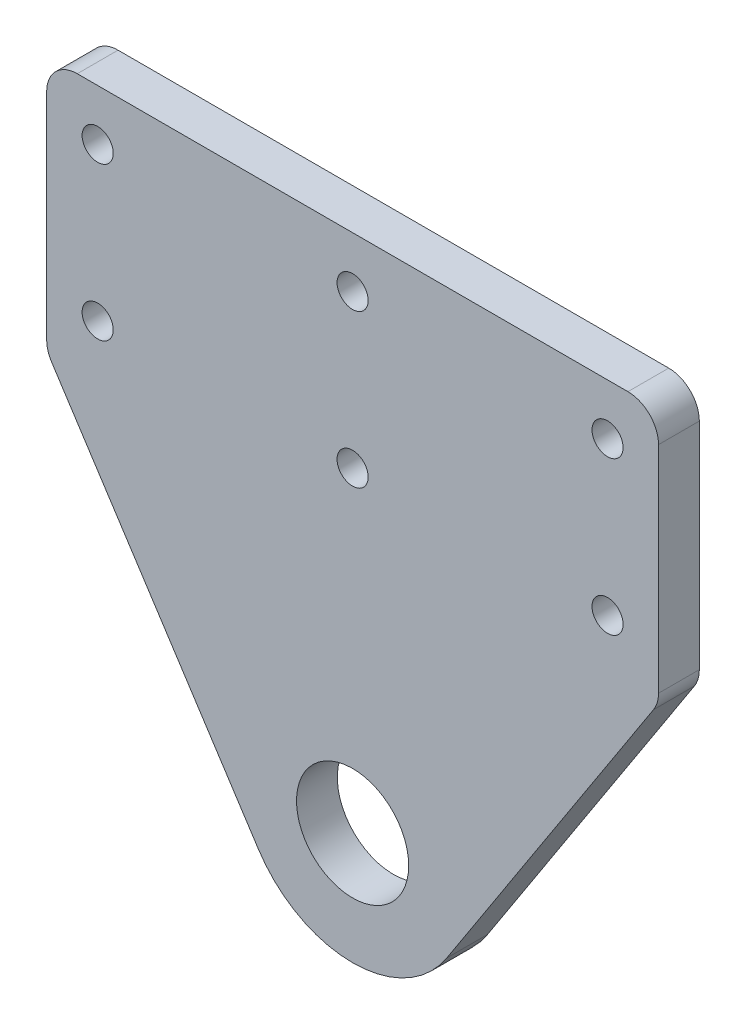
from build123d import *

# Parameters (mm, degrees)
SKETCH_1_R          = 5.5
EXTRUDE_1_DEPTH     = 4
FILLET_1_R          = 3
SKETCH_3_R          = 1.525
CUT_EXTRUDE_2_DEPTH = 10


with BuildPart() as part:
    # 草图1 → 凸台-拉伸1 (new body)
    with BuildSketch(Plane.XY):
        with BuildLine():
            Line((-9.225454443, -5.990908973), (-30, 26))
            Line((-30, 26), (-30, 51))
            Line((-30, 51), (30, 51))
            Line((30, 51), (30, 26))
            Line((30, 26), (9.225454443, -5.990908973))
            ThreePointArc((9.225454443, -5.990908973), (0, -11), (-9.225454443, -5.990908973))
        make_face()
        Circle(SKETCH_1_R, mode=Mode.SUBTRACT)
    extrude(amount=EXTRUDE_1_DEPTH)

    # 圆角1
    fillet_1_edges = [part.edges().sort_by_distance(p)[0] for p in [
        (-30, 26, 2),
        (-30, 51, 2),
        (30, 51, 2),
        (30, 26, 2),
    ]]
    fillet(fillet_1_edges, radius=FILLET_1_R)

    # 草图3 → 切除-拉伸2 (cut)
    with BuildSketch(Plane(origin=(0, 0, 0), x_dir=(-1, 0, 0), z_dir=(0, 0, -1))):
        with Locations((25, 31)):
            Circle(SKETCH_3_R)
        with Locations((25, 46)):
            Circle(SKETCH_3_R)
        with Locations((0, 31)):
            Circle(SKETCH_3_R)
        with Locations((0, 46)):
            Circle(SKETCH_3_R)
        with Locations((-25, 31)):
            Circle(SKETCH_3_R)
        with Locations((-25, 46)):
            Circle(SKETCH_3_R)
    extrude(amount=-CUT_EXTRUDE_2_DEPTH, mode=Mode.SUBTRACT)


solid = part.part
